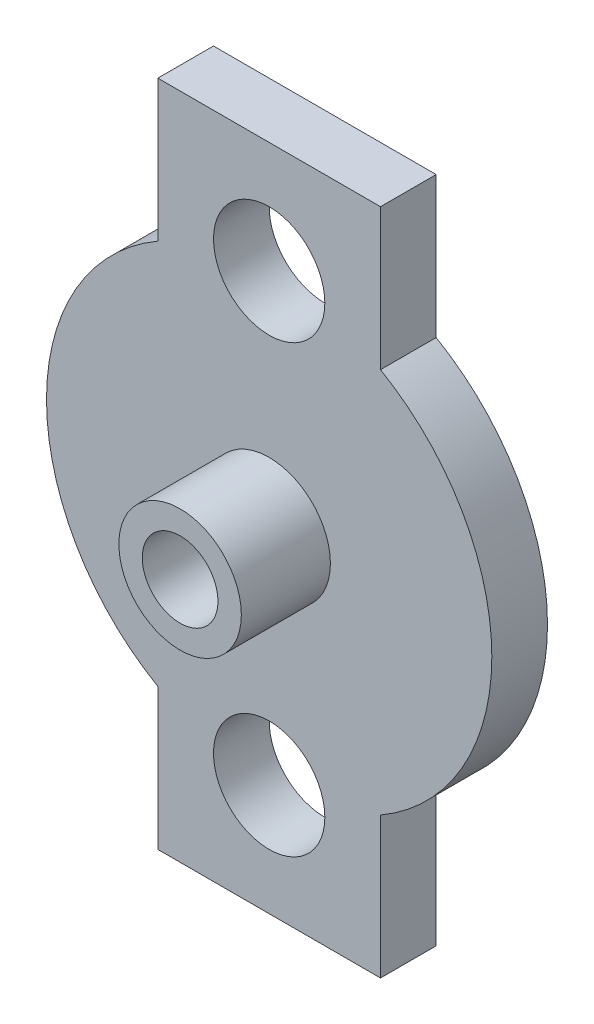
from build123d import *

# Parameters (mm, degrees)
ESQUISSE4_R             = 10
BOSS_EXTRU_3_DEPTH      = 2.5
ESQUISSE5_R             = 0.8
ENL_V_MAT_EXTRU_2_DEPTH = 3
ESQUISSE6_R             = 2.75
ESQUISSE6_R_2           = 1.7
BOSS_EXTRU_4_DEPTH      = 4
ENL_V_START             = -1
ESQUISSE10_R            = 1.7
ENL_V_MAT_EXTRU_3_DEPTH = 1
BOSS_EXTRU_8_START      = -2.5
BOSS_EXTRU_8_DEPTH      = 2.5
ESQUISSE19_R            = 2.5
ENL_V_MAT_EXTRU_4_DEPTH = 3


with BuildPart() as part:
    # Esquisse4 → Boss.-Extru.3 (new body)
    with BuildSketch(Plane.XY):
        Circle(ESQUISSE4_R)
    extrude(amount=BOSS_EXTRU_3_DEPTH)

    # Esquisse5 → Enlèv. mat.-Extru.2 (cut)
    with BuildSketch(Plane.XY.offset(2.5)):
        Circle(ESQUISSE5_R)
    extrude(amount=-ENL_V_MAT_EXTRU_2_DEPTH, mode=Mode.SUBTRACT)

    # Esquisse6 → Boss.-Extru.4 (add)
    with BuildSketch(Plane.XY.offset(2.5)):
        Circle(ESQUISSE6_R)
        Circle(ESQUISSE6_R_2, mode=Mode.SUBTRACT)
    extrude(amount=BOSS_EXTRU_4_DEPTH)

    # Esquisse10 → Enlèv. mat.-Extru.3 (cut)
    with BuildSketch(Plane.XY.offset(2.5).offset(ENL_V_START)):
        Circle(ESQUISSE10_R)
    extrude(amount=ENL_V_MAT_EXTRU_3_DEPTH, mode=Mode.SUBTRACT)

    # Esquisse17 → Boss.-Extru.8 (add)
    with BuildSketch(Plane.XY.offset(2.5).offset(BOSS_EXTRU_8_START)):
        with BuildLine():
            Line((-5, -8.660254038), (-5, -15))
            Line((-5, -15), (5, -15))
            Line((5, -15), (5, -8.660254038))
            ThreePointArc((5, -8.660254038), (0, -10), (-5, -8.660254038))
        make_face()
        with BuildLine():
            Line((5, 15), (5, 8.660254038))
            ThreePointArc((5, 8.660254038), (0, 10), (-5, 8.660254038))
            Line((-5, 8.660254038), (-5, 15))
            Line((-5, 15), (5, 15))
        make_face()
    extrude(amount=BOSS_EXTRU_8_DEPTH)

    # Esquisse19 → Enlèv. mat.-Extru.4 (cut)
    with BuildSketch(Plane.XY.offset(2.5)):
        with Locations((0, -10)):
            Circle(ESQUISSE19_R)
        with Locations((0, 10)):
            Circle(ESQUISSE19_R)
    extrude(amount=-ENL_V_MAT_EXTRU_4_DEPTH, mode=Mode.SUBTRACT)


solid = part.part
